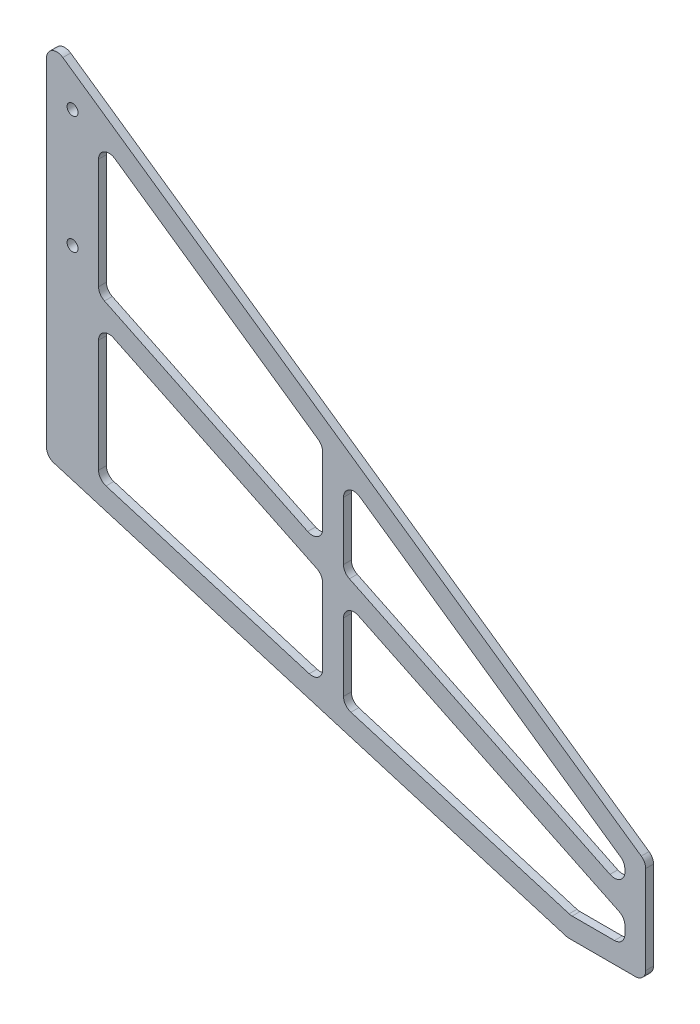
from build123d import *

# Parameters (mm, degrees)
EXTRUDE_1_DEPTH     = 3
SKETCH_2_R          = 2.1
CUT_EXTRUDE_1_DEPTH = 39
CUT_EXTRUDE_2_DEPTH = 10
FILLET_1_R          = 4
FILLET_2_R          = 4


with BuildPart() as part:
    # Эскиз1 → Бобышка-Вытянуть1 (new body)
    with BuildSketch(Plane.XY):
        Polygon((0, 0), (0, 140), (230, -20), (230, -60), (200, -60), align=None)
    extrude(amount=EXTRUDE_1_DEPTH)

    # Эскиз2 → Вырез-Вытянуть1 (cut)
    with BuildSketch(Plane.XY.offset(3)):
        with Locations((10, 75)):
            Circle(SKETCH_2_R)
        with Locations((10, 120.2)):
            Circle(SKETCH_2_R)
    extrude(amount=-CUT_EXTRUDE_1_DEPTH, mode=Mode.SUBTRACT)

    # Эскиз5 → Вырез-Вытянуть2 (cut)
    with BuildSketch(Plane.XY.offset(3)):
        Polygon((222, -24.180122244), (222, -33.649029765), (114, 18.445995751), (114, 50.950312538), align=None)
        Polygon((20, 63.787962403), (106, 22.304886529), (106, 56.51552993), (20, 116.341616886), align=None)
        Polygon((20, 54.90589969), (106, 13.422823816), (106, -23.447754793), (20, 2.352245207), align=None)
        Polygon((201.17415069, -52), (222, -52), (222, -42.531092479), (114, 9.563933037), (114, -25.847754793), align=None)
    extrude(amount=-CUT_EXTRUDE_2_DEPTH, mode=Mode.SUBTRACT)

    # Скругление1
    fillet_1_edges = [part.edges().sort_by_distance(p)[0] for p in [
        (0, 0, 1.5),
        (0, 140, 1.5),
        (230, -20, 1.5),
        (230, -60, 1.5),
        (200, -60, 1.5),
    ]]
    fillet(fillet_1_edges, radius=FILLET_1_R)

    # Скругление2
    fillet_2_edges = [part.edges().sort_by_distance(p)[0] for p in [
        (20, 2.352245207, 1.5),
        (20, 54.90589969, 1.5),
        (106, 13.422823816, 1.5),
        (106, -23.447754793, 1.5),
        (114, 50.950312538, 1.5),
        (222, -24.180122244, 1.5),
        (222, -33.649029765, 1.5),
        (114, 18.445995751, 1.5),
        (222, -42.531092479, 1.5),
        (222, -52, 1.5),
        (201.17415069, -52, 1.5),
        (114, -25.847754793, 1.5),
        (114, 9.563933037, 1.5),
        (20, 116.341616886, 1.5),
        (106, 56.51552993, 1.5),
        (106, 22.304886529, 1.5),
        (20, 63.787962403, 1.5),
    ]]
    fillet(fillet_2_edges, radius=FILLET_2_R)


solid = part.part
